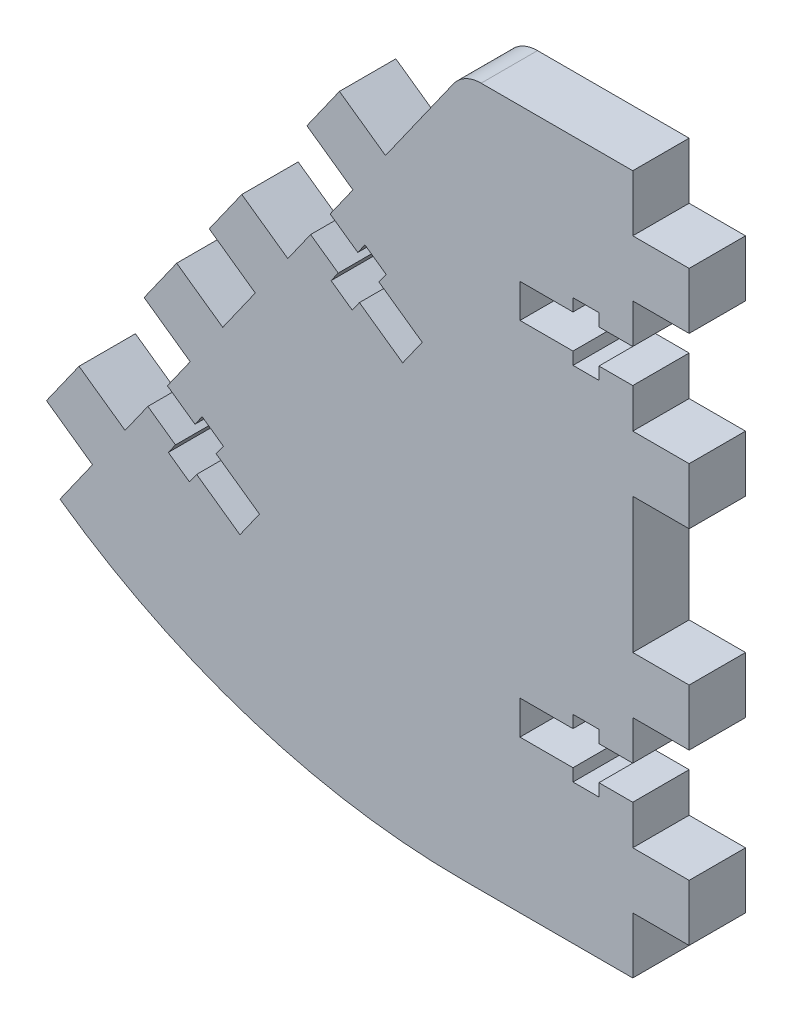
from build123d import *

# Parameters (mm, degrees)
BOSS_EXTRU_1_DEPTH = 5
CONG_1_R           = 3


with BuildPart() as part:
    # Esquisse1 → Boss.-Extru.1 (new body)
    with BuildSketch(Plane.XY):
        with BuildLine():
            Line((0, -5), (0, 0))
            Line((0, 0), (-15, 0))
            Line((-15, 0), (-21.92820323, -9.797958971))
            Line((-21.92820323, -9.797958971), (-26.010686135, -6.911207626))
            Line((-26.010686135, -6.911207626), (-28.89743748, -10.99369053))
            Line((-28.89743748, -10.99369053), (-24.814954576, -13.880441876))
            Line((-24.814954576, -13.880441876), (-26.835680518, -16.73817991))
            Line((-26.835680518, -16.73817991), (-24.386190775, -18.470230717))
            Line((-24.386190775, -18.470230717), (-23.751105479, -17.572084478))
            Line((-23.751105479, -17.572084478), (-21.873163342, -18.899990097))
            Line((-21.873163342, -18.899990097), (-22.508248639, -19.798136336))
            Line((-22.508248639, -19.798136336), (-18.670714708, -22.511682601))
            Line((-18.670714708, -22.511682601), (-20.402765515, -24.961172344))
            Line((-20.402765515, -24.961172344), (-24.240299446, -22.247626079))
            Line((-24.240299446, -22.247626079), (-24.875384742, -23.145772318))
            Line((-24.875384742, -23.145772318), (-26.753326878, -21.817866699))
            Line((-26.753326878, -21.817866699), (-26.118241582, -20.91972046))
            Line((-26.118241582, -20.91972046), (-28.567731325, -19.187669652))
            Line((-28.567731325, -19.187669652), (-30.588457267, -22.045407686))
            Line((-30.588457267, -22.045407686), (-34.670940172, -19.15865634))
            Line((-34.670940172, -19.15865634), (-37.557691518, -23.241139245))
            Line((-37.557691518, -23.241139245), (-33.475208613, -26.127890591))
            Line((-33.475208613, -26.127890591), (-36.361959959, -30.210373495))
            Line((-36.361959959, -30.210373495), (-40.444442863, -27.32362215))
            Line((-40.444442863, -27.32362215), (-43.331194209, -31.406105054))
            Line((-43.331194209, -31.406105054), (-39.248711304, -34.2928564))
            Line((-39.248711304, -34.2928564), (-41.269437246, -37.150594433))
            Line((-41.269437246, -37.150594433), (-38.819947503, -38.882645241))
            Line((-38.819947503, -38.882645241), (-38.184862207, -37.984499002))
            Line((-38.184862207, -37.984499002), (-36.306920071, -39.312404621))
            Line((-36.306920071, -39.312404621), (-36.942005367, -40.21055086))
            Line((-36.942005367, -40.21055086), (-33.104471437, -42.924097125))
            Line((-33.104471437, -42.924097125), (-34.836522244, -45.373586868))
            Line((-34.836522244, -45.373586868), (-38.674056175, -42.660040603))
            Line((-38.674056175, -42.660040603), (-39.309141471, -43.558186842))
            Line((-39.309141471, -43.558186842), (-41.187083607, -42.230281223))
            Line((-41.187083607, -42.230281223), (-40.551998311, -41.332134984))
            Line((-40.551998311, -41.332134984), (-43.001488054, -39.600084176))
            Line((-43.001488054, -39.600084176), (-45.022213996, -42.45782221))
            Line((-45.022213996, -42.45782221), (-49.104696901, -39.571070864))
            Line((-49.104696901, -39.571070864), (-51.991448246, -43.653553769))
            Line((-51.991448246, -43.653553769), (-47.908965342, -46.540305114))
            Line((-47.908965342, -46.540305114), (-50.795716687, -50.622788019))
            ThreePointArc((-50.795716687, -50.622788019), (-33.780137683, -59.08727806), (-15, -62))
            Line((-15, -62), (0, -62))
            Line((0, -62), (0, -57))
            Line((0, -57), (5, -57))
            Line((5, -57), (5, -52))
            Line((5, -52), (0, -52))
            Line((0, -52), (0, -48.5))
            Line((0, -48.5), (-3, -48.5))
            Line((-3, -48.5), (-3, -49.6))
            Line((-3, -49.6), (-5.3, -49.6))
            Line((-5.3, -49.6), (-5.3, -48.5))
            Line((-5.3, -48.5), (-10, -48.5))
            Line((-10, -48.5), (-10, -45.5))
            Line((-10, -45.5), (-5.3, -45.5))
            Line((-5.3, -45.5), (-5.3, -44.4))
            Line((-5.3, -44.4), (-3, -44.4))
            Line((-3, -44.4), (-3, -45.5))
            Line((-3, -45.5), (0, -45.5))
            Line((0, -45.5), (0, -42))
            Line((0, -42), (5, -42))
            Line((5, -42), (5, -37))
            Line((5, -37), (0, -37))
            Line((0, -37), (0, -25))
            Line((0, -25), (5, -25))
            Line((5, -25), (5, -20))
            Line((5, -20), (0, -20))
            Line((0, -20), (0, -16.5))
            Line((0, -16.5), (-3, -16.5))
            Line((-3, -16.5), (-3, -17.6))
            Line((-3, -17.6), (-5.3, -17.6))
            Line((-5.3, -17.6), (-5.3, -16.5))
            Line((-5.3, -16.5), (-10, -16.5))
            Line((-10, -16.5), (-10, -13.5))
            Line((-10, -13.5), (-5.3, -13.5))
            Line((-5.3, -13.5), (-5.3, -12.4))
            Line((-5.3, -12.4), (-3, -12.4))
            Line((-3, -12.4), (-3, -13.5))
            Line((-3, -13.5), (0, -13.5))
            Line((0, -13.5), (0, -10))
            Line((0, -10), (5, -10))
            Line((5, -10), (5, -5))
            Line((5, -5), (0, -5))
        make_face()
    extrude(amount=BOSS_EXTRU_1_DEPTH)

    # Congé1
    cong_1_edges = [part.edges().sort_by_distance(p)[0] for p in [
        (-15, 0, 2.5),
    ]]
    fillet(cong_1_edges, radius=CONG_1_R)


solid = part.part
